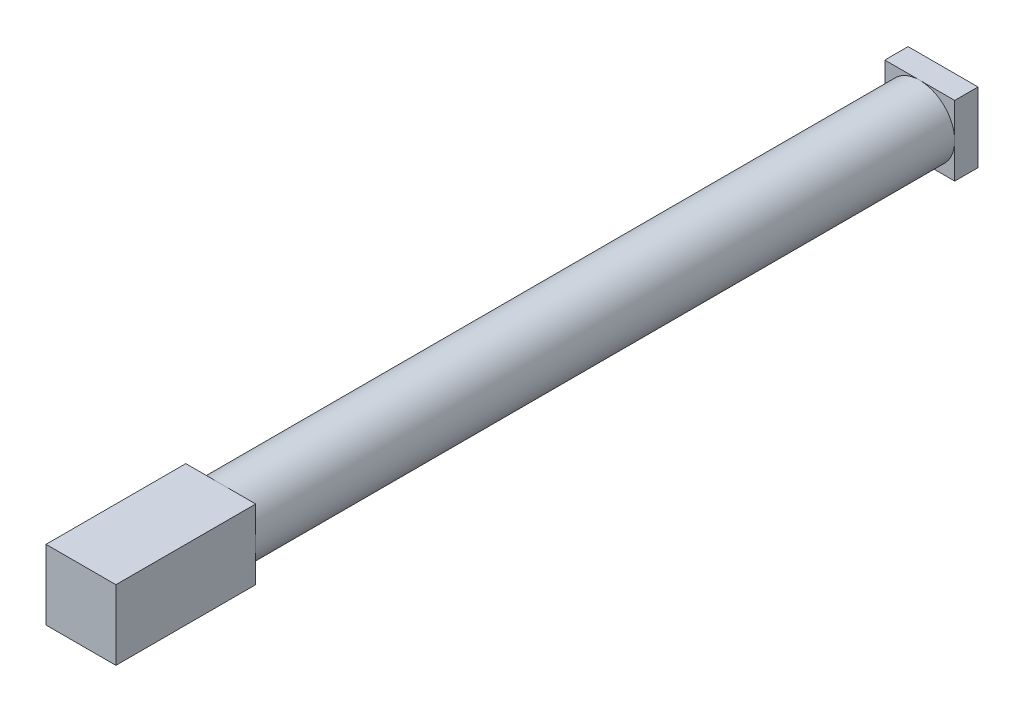
from build123d import *

# Parameters (mm, degrees)
SKETCH1_R           = 1.905
BOSS_EXTRUDE1_DEPTH = 19.05
SKETCH2_W           = 3.81
SKETCH2_H           = 3.81
BOSS_EXTRUDE2_DEPTH = 7.62
SKETCH3_W           = 3.81
SKETCH3_H           = 3.81
BOSS_EXTRUDE3_DEPTH = 1.27


with BuildPart() as part:
    # Sketch1 → Boss-Extrude1 (new, symmetric)
    with BuildSketch(Plane.XY):
        with Locations(Location((0, 0, 0), (0, 0, 180))):
            Circle(SKETCH1_R)
    extrude(amount=BOSS_EXTRUDE1_DEPTH, both=True)

    # Sketch2 → Boss-Extrude2 (add)
    with BuildSketch(Plane.XY.offset(19.05)):
        Rectangle(SKETCH2_W, SKETCH2_H)
    extrude(amount=BOSS_EXTRUDE2_DEPTH)

    # Sketch3 → Boss-Extrude3 (add)
    with BuildSketch(Plane(origin=(0, 0, -19.05), x_dir=(-1, 0, 0), z_dir=(0, 0, -1))):
        Rectangle(SKETCH3_W, SKETCH3_H)
    extrude(amount=BOSS_EXTRUDE3_DEPTH)


solid = part.part
